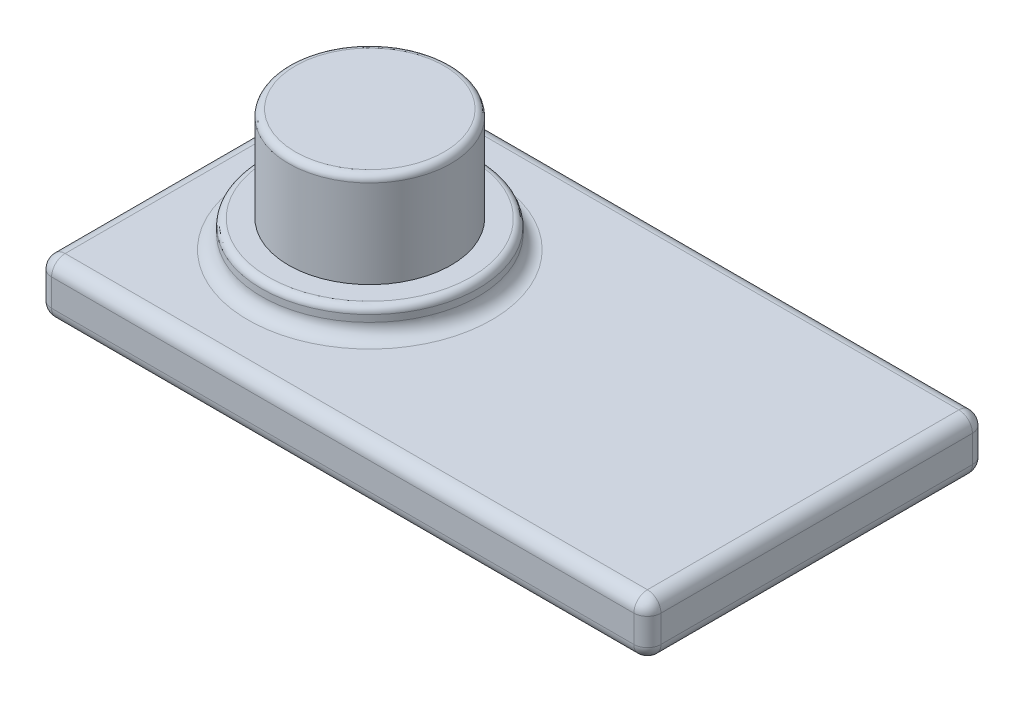
from build123d import *

# Parameters (mm, degrees)
SKETCH_1_W      = 22.5
SKETCH_1_H      = 12.5
EXTRUDE_1_DEPTH = 2
SKETCH_2_R      = 4
EXTRUDE_2_DEPTH = 1
SKETCH_3_R      = 3
EXTRUDE_3_DEPTH = 3.5
FILLET_1_R      = 0.5
FILLET_2_R      = 0.25


with BuildPart() as part:
    # 草图1 → 凸台-拉伸1 (new body)
    with BuildSketch(Plane(origin=(0, 0, 0), x_dir=(1, 0, 0), z_dir=(0, 1, 0))):
        with Locations((11.25, 6.25)):
            Rectangle(SKETCH_1_W, SKETCH_1_H)
    extrude(amount=EXTRUDE_1_DEPTH)

    # 草图2 → 凸台-拉伸2 (add)
    with BuildSketch(Plane(origin=(0, 2, 0), x_dir=(1, 0, 0), z_dir=(0, 1, 0))):
        with Locations(Location((6, 6.25, 0), (0, 0, 90))):
            Circle(SKETCH_2_R)
    extrude(amount=EXTRUDE_2_DEPTH)

    # 草图3 → 凸台-拉伸3 (add)
    with BuildSketch(Plane(origin=(0, 3, 0), x_dir=(1, 0, 0), z_dir=(0, 1, 0))):
        with Locations(Location((6, 6.25, 0), (0, 0, 270))):
            Circle(SKETCH_3_R)
    extrude(amount=EXTRUDE_3_DEPTH)

    # 圆角1
    fillet_1_edges = [part.edges().sort_by_distance(p)[0] for p in [
        (22.5, 2, -6.25),
        (6, 2, -2.25),
        (11.25, 2, -12.5),
        (0, 2, -6.25),
        (11.25, 0, -12.5),
        (22.5, 0, -6.25),
        (11.25, 0, 0),
        (0, 0, -6.25),
        (0, 1, -12.5),
        (22.5, 1, -12.5),
        (22.5, 1, 0),
        (0, 1, 0),
        (11.25, 2, 0),
    ]]
    fillet(fillet_1_edges, radius=FILLET_1_R)

    # 圆角2
    fillet_2_edges = [part.edges().sort_by_distance(p)[0] for p in [
        (6, 3, -2.25),
        (6, 6.5, -9.25),
    ]]
    fillet(fillet_2_edges, radius=FILLET_2_R)


solid = part.part
